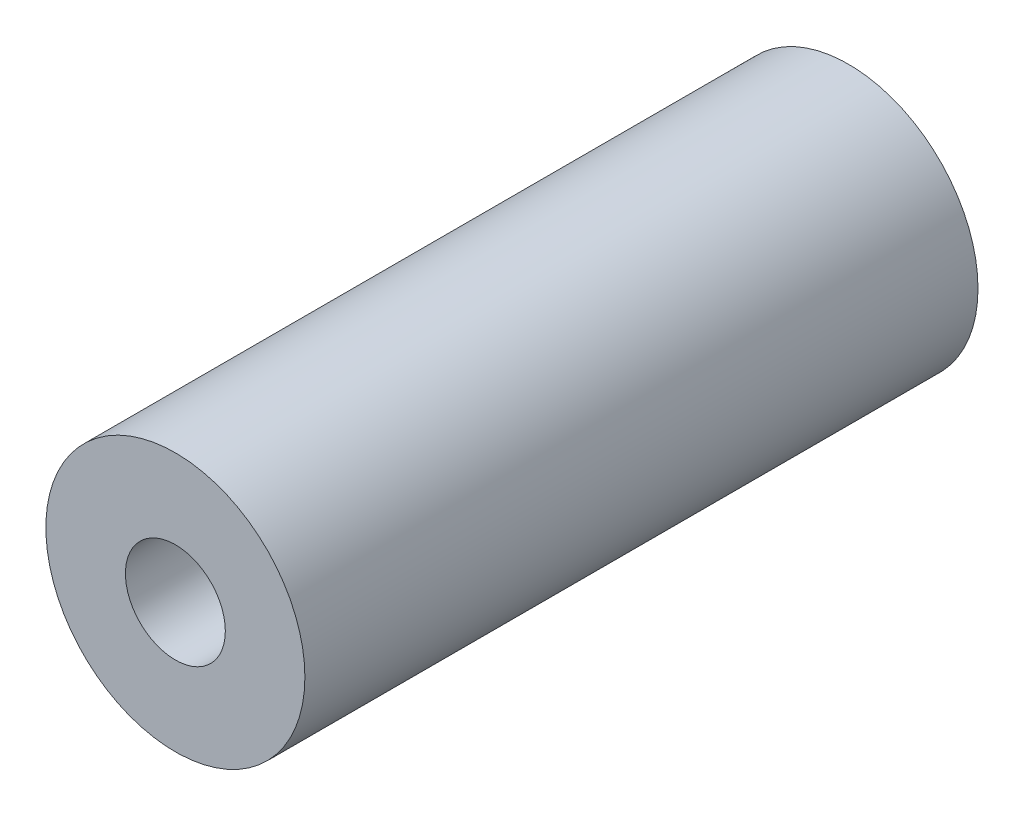
from build123d import *

# Parameters (mm, degrees)
SKETCH1_R           = 3.5
SKETCH1_R_2         = 1.35
BOSS_EXTRUDE1_DEPTH = 18.187976831


with BuildPart() as part:
    # Sketch1 → Boss-Extrude1 (new body)
    with BuildSketch(Plane.XY):
        Circle(SKETCH1_R)
        Circle(SKETCH1_R_2, mode=Mode.SUBTRACT)
    extrude(amount=-BOSS_EXTRUDE1_DEPTH)


solid = part.part
